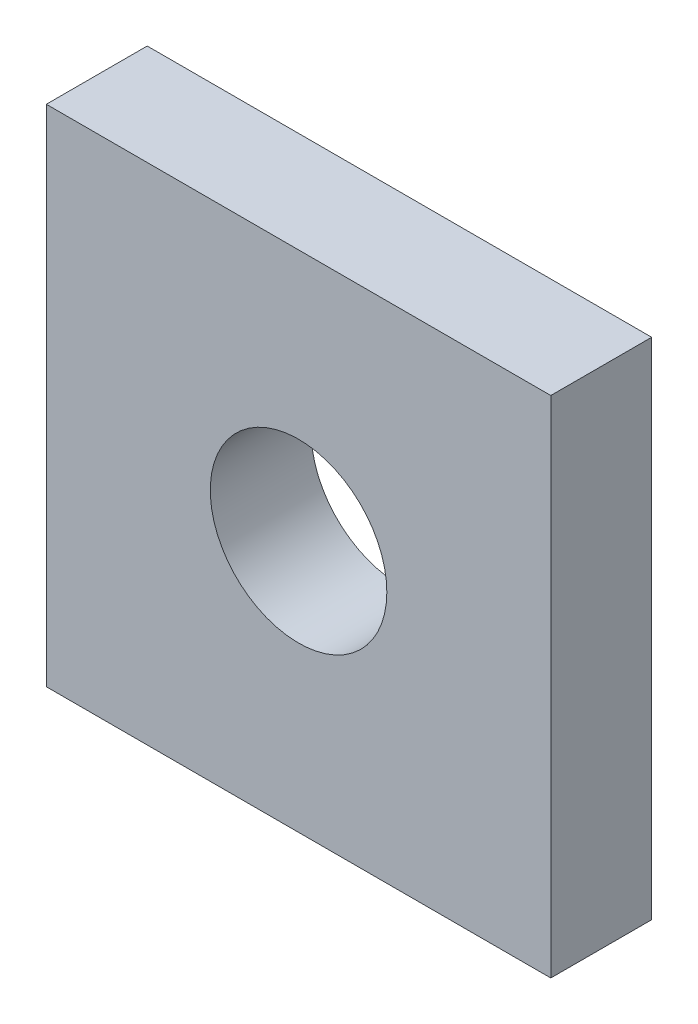
from build123d import *

# Parameters (mm, degrees)
SKETCH_1_W      = 50
SKETCH_1_H      = 50
SKETCH_1_R      = 8.75
EXTRUDE_1_DEPTH = 10


with BuildPart() as part:
    # 草图1 → 凸台-拉伸1 (new body)
    with BuildSketch(Plane.XY):
        Rectangle(SKETCH_1_W, SKETCH_1_H)
        Circle(SKETCH_1_R, mode=Mode.SUBTRACT)
    extrude(amount=EXTRUDE_1_DEPTH)


solid = part.part
